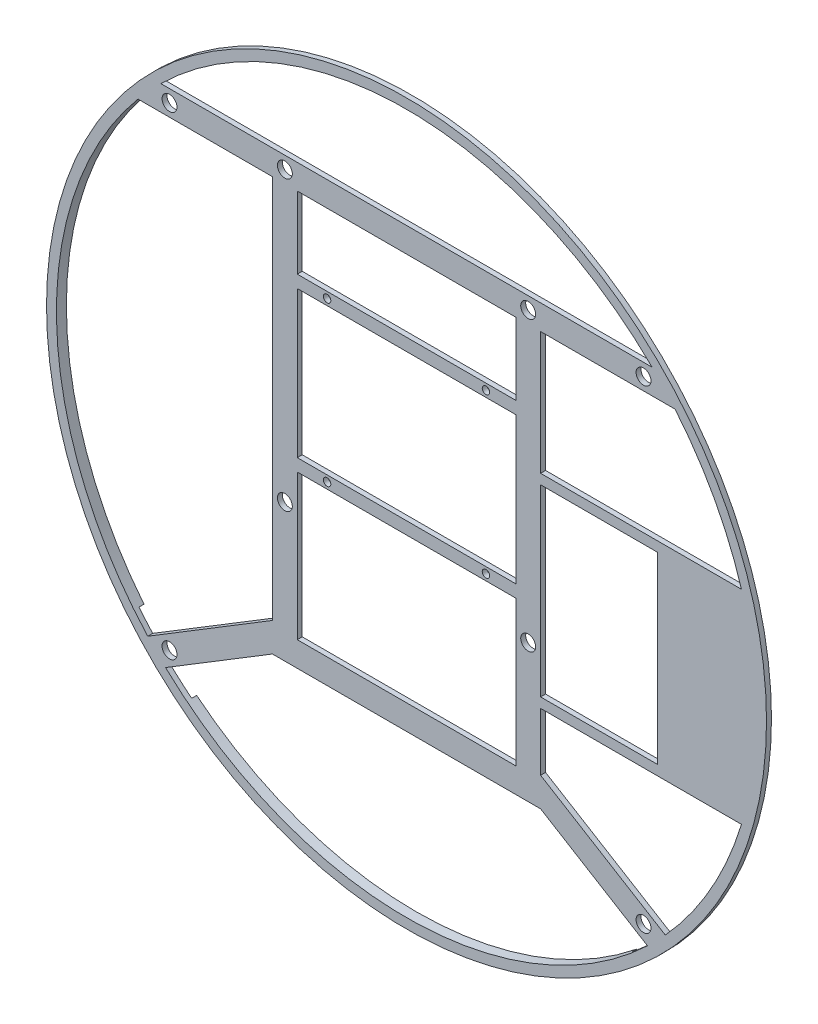
from build123d import *

# Parameters (mm, degrees)
SKIZZE1_R                = 72.5
SKIZZE1_R_2              = 70.5
BASE_RING_DEPTH          = 1
SKIZZE2_W                = 22
SKIZZE2_H                = 2.5
RASPBERRY_FRAME_DEPTH    = 1
SCREWS_I_D               = 3
FAN_SCREWS_D             = 1.5
TOP_START                = -1
SKIZZE7_W                = 23.5
SKIZZE7_H                = 2
TOP_COVER_DEPTH          = 1
INNER_START              = 1
INNER_RING_DEPTH         = 1
LOWER_COVER_CUT_DEPTH    = 103.535359755
COVER_CUT_ROTATION_COUNT = 4


with BuildPart() as part:
    # Skizze1 → Base Ring (new body)
    with BuildSketch(Plane.XY):
        Circle(SKIZZE1_R)
        Circle(SKIZZE1_R_2, mode=Mode.SUBTRACT)
    extrude(amount=BASE_RING_DEPTH)

    # Skizze2 → Raspberry Frame (add)
    with BuildSketch(Plane.XY):
        with BuildLine():
            Line((0, 50.22970773), (-49.469449778, 50.22970773))
            ThreePointArc((-49.469449778, 50.22970773), (-51.834480078, 47.785318614), (-54.078864066, 45.22970773))
            Line((-54.078864066, 45.22970773), (-27, 45.22970773))
            Line((-27, 45.22970773), (-22, 45.22970773))
            Line((-22, 45.22970773), (0, 45.22970773))
            Line((0, 45.22970773), (0, 50.22970773))
        make_face()
        Polygon((-22, 45.22970773), (-27, 45.22970773), (-27, -32.164435383), (-27, -33.02029227), (-22, -33.02029227), (-22, -3.77029227), (-22, -1.27029227), (-22, 28.22970773), (-22, 30.72970773), align=None)
        with BuildLine():
            Line((-27, -32.164435383), (-52.117379441, -47.476612771))
            ThreePointArc((-52.117379441, -47.476612771), (-50.354632641, -49.34228381), (-48.5251414, -51.142552264))
            Line((-48.5251414, -51.142552264), (-27, -38.02029227))
            Line((-27, -38.02029227), (-27, -33.02029227))
            Line((-27, -33.02029227), (-27, -32.164435383))
        make_face()
        Polygon((-27, -33.02029227), (-27, -38.02029227), (0, -38.02029227), (0, -33.02029227), (-22, -33.02029227), align=None)
        with Locations((-11, 29.47970773)):
            Rectangle(SKIZZE2_W, SKIZZE2_H)
        with Locations((-11, -2.52029227)):
            Rectangle(SKIZZE2_W, SKIZZE2_H)
    raspberry_frame = extrude(amount=RASPBERRY_FRAME_DEPTH)

    # Screws I (through all)
    with Locations(Plane.XY.offset(1)):
        with Locations((-47.72970773, -47.72970773), (-24.5, -10.27029227), (-47.72970773, 47.72970773), (-24.5, 47.72970773)):
            screws_i = Hole(SCREWS_I_D / 2)

    # Fan Screws (through all)
    with Locations(Plane.XY.offset(1)):
        with Locations((-16, 29.47970773), (-16, -2.52029227)):
            fan_screws = Hole(FAN_SCREWS_D / 2)

    # Mirror I: Raspberry Frame, Screws I, Fan Screws across plane
    add(raspberry_frame.mirror(Plane(origin=(0, 0, 0), x_dir=(0, 0, 1), z_dir=(1, 0, 0))))
    add(screws_i.mirror(Plane(origin=(0, 0, 0), x_dir=(0, 0, 1), z_dir=(1, 0, 0))), mode=Mode.SUBTRACT)
    add(fan_screws.mirror(Plane(origin=(0, 0, 0), x_dir=(0, 0, 1), z_dir=(1, 0, 0))), mode=Mode.SUBTRACT)

    # Skizze7 → Top Cover (add)
    with BuildSketch(Plane.XY.offset(1).offset(TOP_START)):
        with BuildLine():
            Line((50.5, -18.5), (50.5, -20.5))
            Line((50.5, -20.5), (67.453687816, -20.5))
            ThreePointArc((67.453687816, -20.5), (69.734263426, -10.36255299), (70.5, 0))
            ThreePointArc((70.5, 0), (69.734263426, 10.36255299), (67.453687816, 20.5))
            Line((67.453687816, 20.5), (50.5, 20.5))
            Line((50.5, 20.5), (50.5, 18.5))
            Line((50.5, 18.5), (50.5, -18.5))
        make_face()
        with Locations((38.75, 19.5)):
            Rectangle(SKIZZE7_W, SKIZZE7_H)
        with Locations((38.75, -19.5)):
            Rectangle(SKIZZE7_W, SKIZZE7_H)
    extrude(amount=TOP_COVER_DEPTH)

    # Skizze8 → Inner Ring (add)
    with BuildSketch(Plane(origin=(0, 0, 0), x_dir=(-1, 0, 0), z_dir=(0, 0, -1)).offset(INNER_START)):
        with BuildLine():
            Line((-67.976098741, 20.5), (-67.453687816, 20.5))
            ThreePointArc((-67.453687816, 20.5), (70.5, 0), (-67.453687816, -20.5))
            Line((-67.453687816, -20.5), (-67.976098741, -20.5))
            ThreePointArc((-67.976098741, -20.5), (71, 0), (-67.976098741, 20.5))
        make_face()
    extrude(amount=-INNER_RING_DEPTH)

    # Skizze9 → Lower Cover Cut (cut, through all)
    with BuildSketch(Plane(origin=(0, 0, 0), x_dir=(-1, 0, 0), z_dir=(0, 0, -1))):
        Polygon((-45.961940777, -56.568542495), (-38.890872965, -49.497474683), (-49.497474683, -38.890872965), (-56.568542495, -45.961940777), align=None)
    lower_cover_cut = extrude(amount=LOWER_COVER_CUT_DEPTH, mode=Mode.SUBTRACT)

    # Cover Cut Rotation: Lower Cover Cut ×4 about axis
    cover_cut_rotation_axis = Axis((0, 0, 0), (0, 0, 1))
    for i in range(1, COVER_CUT_ROTATION_COUNT):
        add(lower_cover_cut.rotate(cover_cut_rotation_axis, i * 360 / COVER_CUT_ROTATION_COUNT), mode=Mode.SUBTRACT)


solid = part.part
